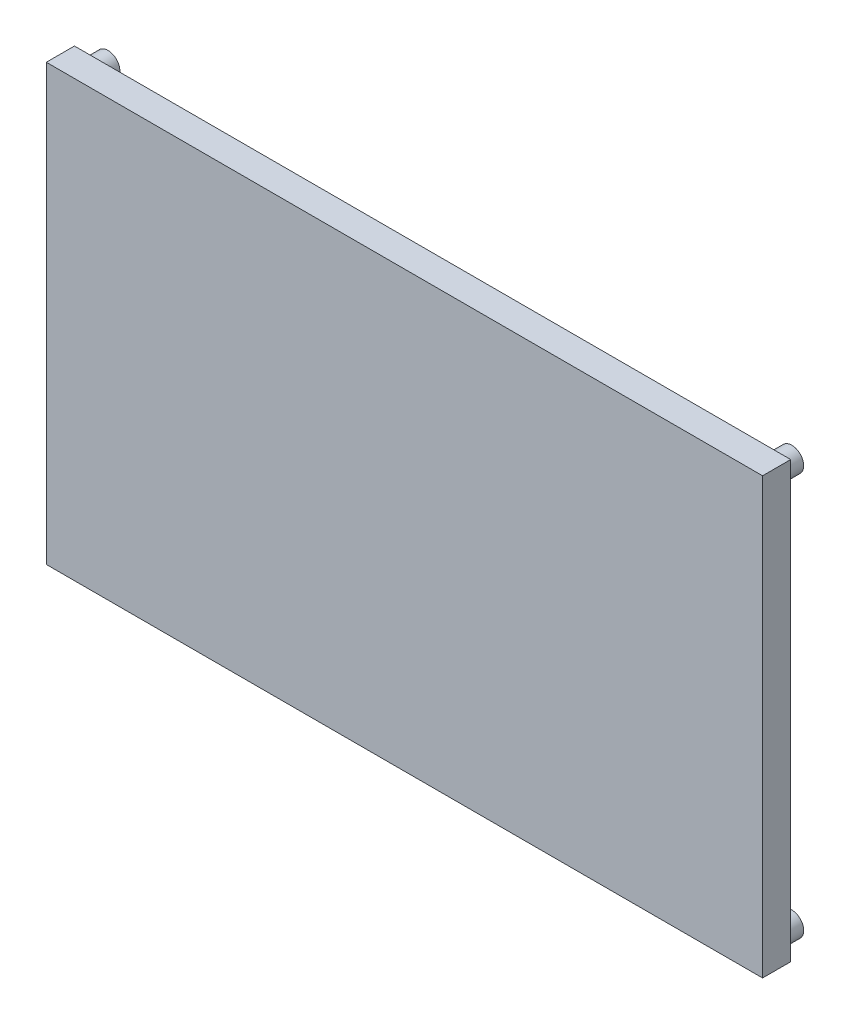
from build123d import *

# Parameters (mm, degrees)
SKETCH_1_W                                 = 165.5
SKETCH_1_H                                 = 100.5
EXTRUDE_1_DEPTH                            = 3.25
SKETCH_2_R                                 = 2.75
EXTRUDE_2_DEPTH                            = 4
MIRROR_1_AT_THE_SECOND_PLANE_COPY_1_SKET_R = 2.75
MIRROR_1_AT_THE_SECOND_PLANE_COPY_1_DEPTH  = 4


with BuildPart() as part:
    # 草图1 → 凸台-拉伸1 (new, symmetric)
    with BuildSketch(Plane.XY):
        Rectangle(SKETCH_1_W, SKETCH_1_H)
    extrude(amount=EXTRUDE_1_DEPTH, both=True)

    # 草图2 → 凸台-拉伸2 (add)
    with BuildSketch(Plane(origin=(0, 0, -3.25), x_dir=(-1, 0, 0), z_dir=(0, 0, -1))):
        with Locations((79, 46.5)):
            Circle(SKETCH_2_R)
    extrude_2 = extrude(amount=EXTRUDE_2_DEPTH)

    # 镜向1: 凸台-拉伸2 across plane
    add(extrude_2.mirror(Plane.ZX))

    # 镜向1 at the second plane: 凸台-拉伸2 across plane
    add(extrude_2.mirror(Plane(origin=(0, 0, 0), x_dir=(0, 0, 1), z_dir=(1, 0, 0))))

    # 镜向1 at the second plane copy 1 sket → 镜向1 at the second plane copy 1 (add)
    with BuildSketch(Plane(origin=(0, 0, -3.25), x_dir=(1, 0, 0), z_dir=(0, 0, -1))):
        with Locations((79, 46.5)):
            Circle(MIRROR_1_AT_THE_SECOND_PLANE_COPY_1_SKET_R)
    extrude(amount=MIRROR_1_AT_THE_SECOND_PLANE_COPY_1_DEPTH)


solid = part.part
